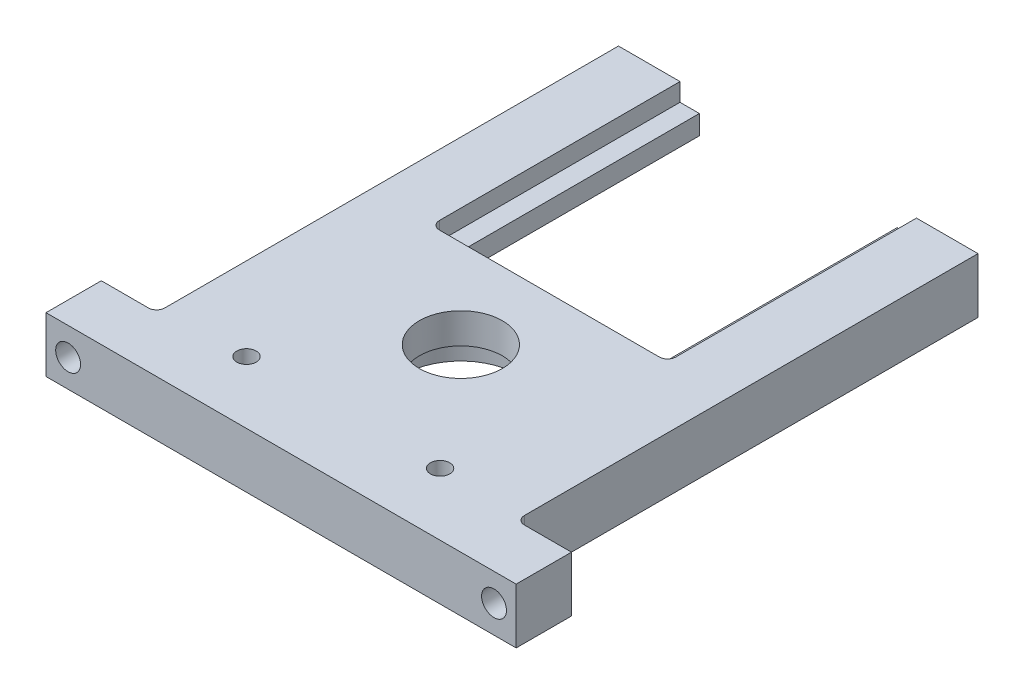
from build123d import *

# Parameters (mm, degrees)
SKETCH1_R                 = 3.5
SKETCH1_R_2               = 15
BOSS_EXTRUDE1_DEPTH       = 10
BOSS_EXTRUDE2_DEPTH       = 3.5
SKETCH2_R                 = 21
CUT_EXTRUDE1_DEPTH        = 9
F_1_0MM_DOWEL_HOLE1_D     = 7
F_1_0MM_DOWEL_HOLE1_DEPTH = 5
SKETCH6_R                 = 4.5
CUT_EXTRUDE2_DEPTH        = 20
M6_TAPPED_HOLE1_D         = 5
M6_TAPPED_HOLE1_DEPTH     = 15
M6_TAPPED_HOLE2_D         = 5
M6_TAPPED_HOLE2_DEPTH     = 15


with BuildPart() as part:
    # Sketch1 → Boss-Extrude1 (new, symmetric)
    with BuildSketch(Plane(origin=(0, 0, 0), x_dir=(1, 0, 0), z_dir=(0, 1, 0))):
        with BuildLine():
            Line((-85, 20), (-85, 0))
            Line((-85, 0), (85, 0))
            Line((85, 0), (85, 20))
            Line((85, 20), (68, 20))
            ThreePointArc((68, 20), (65.878679656, 20.878679656), (65, 23))
            Line((65, 23), (65, 187))
            Line((65, 187), (42.75, 187))
            Line((42.75, 187), (42.75, 100))
            ThreePointArc((42.75, 100), (41.871320344, 97.878679656), (39.75, 97))
            Line((39.75, 97), (32.75, 97))
            Line((32.75, 97), (-32.75, 97))
            Line((-32.75, 97), (-39.75, 97))
            ThreePointArc((-39.75, 97), (-41.871320344, 97.878679656), (-42.75, 100))
            Line((-42.75, 100), (-42.75, 187))
            Line((-42.75, 187), (-65, 187))
            Line((-65, 187), (-65, 23))
            ThreePointArc((-65, 23), (-65.878679656, 20.878679656), (-68, 20))
            Line((-68, 20), (-85, 20))
        make_face()
        with Locations((-35, 22.5)):
            Circle(SKETCH1_R, mode=Mode.SUBTRACT)
        with Locations((35, 22.5)):
            Circle(SKETCH1_R, mode=Mode.SUBTRACT)
        with Locations((0, 65)):
            Circle(SKETCH1_R_2, mode=Mode.SUBTRACT)
    extrude(amount=BOSS_EXTRUDE1_DEPTH, both=True)

    # Sketch1<4> → Boss-Extrude2 (add, symmetric)
    with BuildSketch(Plane(origin=(0, 0, 0), x_dir=(1, 0, 0), z_dir=(0, 1, 0))):
        with BuildLine():
            Line((-35.75, 187), (-42.75, 187))
            Line((-42.75, 187), (-42.75, 100))
            ThreePointArc((-42.75, 100), (-41.871320344, 97.878679656), (-39.75, 97))
            Line((-39.75, 97), (-32.75, 97))
            ThreePointArc((-32.75, 97), (-34.871320344, 97.878679656), (-35.75, 100))
            Line((-35.75, 100), (-35.75, 187))
        make_face()
        with BuildLine():
            Line((42.75, 100), (42.75, 187))
            Line((42.75, 187), (35.75, 187))
            Line((35.75, 187), (35.75, 100))
            ThreePointArc((35.75, 100), (34.871320344, 97.878679656), (32.75, 97))
            Line((32.75, 97), (39.75, 97))
            ThreePointArc((39.75, 97), (41.871320344, 97.878679656), (42.75, 100))
        make_face()
    extrude(amount=BOSS_EXTRUDE2_DEPTH, both=True)

    # Sketch2 → Cut-Extrude1 (cut)
    with BuildSketch(Plane.XZ.offset(10)):
        with Locations((0, -65)):
            Circle(SKETCH2_R)
    extrude(amount=-CUT_EXTRUDE1_DEPTH, mode=Mode.SUBTRACT)

    # Ø1.0mm Dowel Hole1
    with Locations(Plane(origin=(0, 0, -97), x_dir=(-1, 0, 0), z_dir=(0, 0, -1))):
        with Locations((-25, 0), (25, 0)):
            Hole(F_1_0MM_DOWEL_HOLE1_D / 2, depth=F_1_0MM_DOWEL_HOLE1_DEPTH)

    # Sketch6 → Cut-Extrude2 (cut)
    with BuildSketch(Plane.XY):
        with Locations((77, 0)):
            Circle(SKETCH6_R)
        with Locations((-77, 0)):
            Circle(SKETCH6_R)
    extrude(amount=-CUT_EXTRUDE2_DEPTH, mode=Mode.SUBTRACT)

    # M6 Tapped Hole1
    with Locations(Plane(origin=(0, 0, -187), x_dir=(-1, 0, 0), z_dir=(0, 0, -1))):
        with Locations((55, 0)):
            Hole(M6_TAPPED_HOLE1_D / 2, depth=M6_TAPPED_HOLE1_DEPTH)

    # M6 Tapped Hole2
    with Locations(Plane(origin=(0, 0, -187), x_dir=(-1, 0, 0), z_dir=(0, 0, -1))):
        with Locations((-55, 0)):
            Hole(M6_TAPPED_HOLE2_D / 2, depth=M6_TAPPED_HOLE2_DEPTH)


solid = part.part
